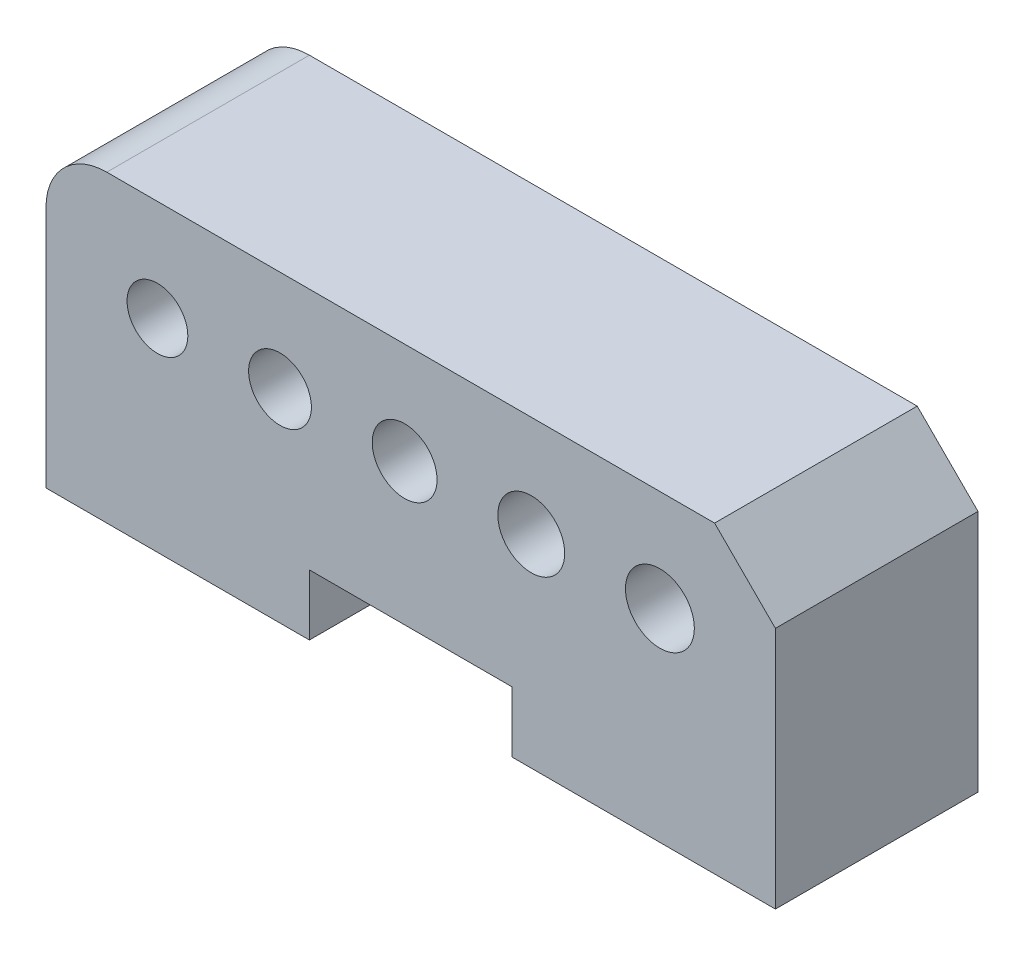
from build123d import *

# Parameters (mm, degrees)
SKETCH1_W           = 36
SKETCH1_H           = 15
SKETCH1_R           = 1.7
SKETCH1_R_2         = 1.65
SKETCH1_R_3         = 1.6
SKETCH1_R_4         = 1.5
SKETCH1_R_5         = 1.55
BOSS_EXTRUDE1_DEPTH = 10
FILLET2_R           = 3
CHAMFER2_SIZE       = 3
SKETCH3_W           = 10
SKETCH3_H           = 6
CUT_EXTRUDE1_DEPTH  = 10


with BuildPart() as part:
    # Sketch1 → Boss-Extrude1 (new body)
    with BuildSketch(Plane.XY):
        with Locations((0, -2.5)):
            Rectangle(SKETCH1_W, SKETCH1_H)
        with Locations((12.3, 0)):
            Circle(SKETCH1_R, mode=Mode.SUBTRACT)
        with Locations((5.95, 0)):
            Circle(SKETCH1_R_2, mode=Mode.SUBTRACT)
        with Locations((-0.3, 0)):
            Circle(SKETCH1_R_3, mode=Mode.SUBTRACT)
        with Locations((-12.5, 0)):
            Circle(SKETCH1_R_4, mode=Mode.SUBTRACT)
        with Locations((-6.45, 0)):
            Circle(SKETCH1_R_5, mode=Mode.SUBTRACT)
    extrude(amount=BOSS_EXTRUDE1_DEPTH)

    # Fillet2
    fillet2_edges = [part.edges().sort_by_distance(p)[0] for p in [
        (-18, 5, 5),
    ]]
    fillet(fillet2_edges, radius=FILLET2_R)

    # Chamfer2
    chamfer2_edges = [part.edges().sort_by_distance(p)[0] for p in [
        (18, 5, 5),
    ]]
    chamfer(chamfer2_edges, length=CHAMFER2_SIZE)

    # Sketch3 → Cut-Extrude1 (cut)
    with BuildSketch(Plane.XY.offset(10)):
        with Locations((0, -10)):
            Rectangle(SKETCH3_W, SKETCH3_H)
    extrude(amount=-CUT_EXTRUDE1_DEPTH, mode=Mode.SUBTRACT)


solid = part.part
